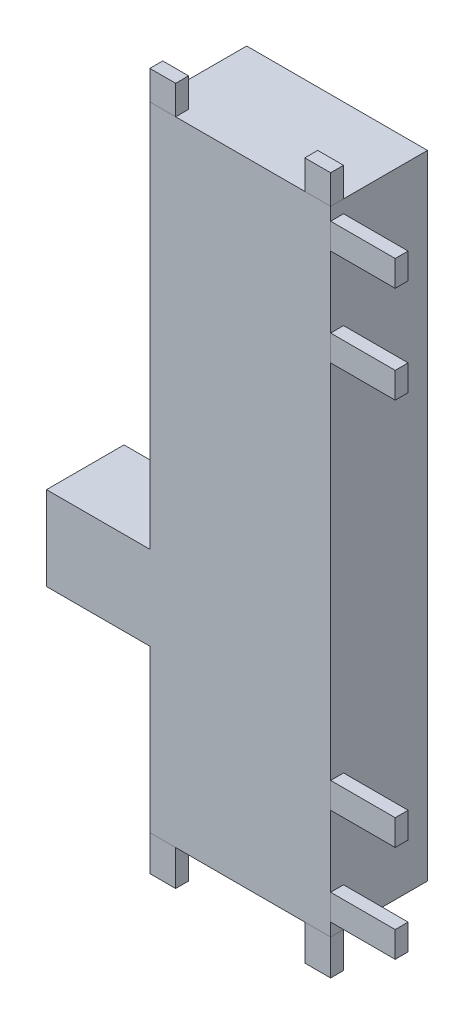
from build123d import *

# Parameters (mm, degrees)
SKETCH1_W             = 2.8
SKETCH1_H             = 9.8
BOSS_EXTRUDE1_DEPTH   = 1.5
SKETCH2_W             = 1
SKETCH2_H             = 0.4
BOSS_EXTRUDE2_DEPTH   = 0.2
BOSS_EXTRUDE2_2_DEPTH = 0.2
BOSS_EXTRUDE2_3_DEPTH = 0.2
BOSS_EXTRUDE2_4_DEPTH = 0.2
SKETCH2_W_2           = 1.6
SKETCH2_H_2           = 1.3
BOSS_EXTRUDE2_5_DEPTH = 0.2
SKETCH2_W_3           = 0.4
SKETCH2_H_3           = 0.55
BOSS_EXTRUDE2_6_DEPTH = 0.2
BOSS_EXTRUDE2_7_DEPTH = 0.2
SKETCH2_H_4           = 0.45
BOSS_EXTRUDE2_8_DEPTH = 0.2
BOSS_EXTRUDE2_9_DEPTH = 0.2
SKETCH3_R             = 0.4
BOSS_EXTRUDE3_DEPTH   = 0.5
CUT_EXTRUDE1_DEPTH    = 1
SKETCH5_W             = 1.6
SKETCH5_H             = 1.3
BOSS_EXTRUDE4_DEPTH   = 1
SKETCH6_W             = 2
SKETCH6_H             = 5.484754905
BOSS_EXTRUDE5_DEPTH   = 0.1


with BuildPart() as part:
    # Sketch1 → Boss-Extrude1 (new body)
    with BuildSketch(Plane.XY):
        Rectangle(SKETCH1_W, SKETCH1_H)
    extrude(amount=BOSS_EXTRUDE1_DEPTH)

    # Sketch3 → Boss-Extrude3 (add)
    with BuildSketch(Plane(origin=(0, 0, 0), x_dir=(-1, 0, 0), z_dir=(0, 0, -1))):
        with Locations(Location((0, -2.5, 0), (0, 0, 180))):
            Circle(SKETCH3_R)
        with Locations(Location((0, 2.5, 0), (0, 0, 180))):
            Circle(SKETCH3_R)
    extrude(amount=BOSS_EXTRUDE3_DEPTH)

    # Sketch4 → Cut-Extrude1 (cut, symmetric)
    with BuildSketch(Plane(origin=(0, 0, 0), x_dir=(0, 0, -1), z_dir=(1, 0, 0))):
        Polygon((-1.23487483, -2.869112244), (-0.744508889, -2.869112244), (-0.744508889, 1.309379028), (-0.190734918, 1.309379028), (-0.190734918, 2.615642661), (-1.23487483, 2.615642661), (-1.5, 2.615642661), (-1.5, -2.869112244), align=None)
    extrude(amount=CUT_EXTRUDE1_DEPTH, both=True, mode=Mode.SUBTRACT)



with BuildPart() as body_2:
    # Sketch2 → Boss-Extrude2 (new body)
    with BuildSketch(Plane.XY.offset(1.5)):
        with Locations((1.9, -4.5)):
            Rectangle(SKETCH2_W, SKETCH2_H)
    extrude(amount=-BOSS_EXTRUDE2_DEPTH)


with BuildPart() as body_3:
    # Sketch2 → Boss-Extrude2 2 (new body)
    with BuildSketch(Plane.XY.offset(1.5)):
        with Locations((1.9, -3)):
            Rectangle(SKETCH2_W, SKETCH2_H)
    extrude(amount=-BOSS_EXTRUDE2_2_DEPTH)


with BuildPart() as body_4:
    # Sketch2 → Boss-Extrude2 3 (new body)
    with BuildSketch(Plane.XY.offset(1.5)):
        with Locations((1.9, 3)):
            Rectangle(SKETCH2_W, SKETCH2_H)
    extrude(amount=-BOSS_EXTRUDE2_3_DEPTH)


with BuildPart() as body_5:
    # Sketch2 → Boss-Extrude2 4 (new body)
    with BuildSketch(Plane.XY.offset(1.5)):
        with Locations((1.9, 4.5)):
            Rectangle(SKETCH2_W, SKETCH2_H)
    extrude(amount=-BOSS_EXTRUDE2_4_DEPTH)


with BuildPart() as body_6:
    # Sketch2 → Boss-Extrude2 5 (new body)
    with BuildSketch(Plane.XY.offset(1.5)):
        with Locations((-2.2, -1.75)):
            Rectangle(SKETCH2_W_2, SKETCH2_H_2)
    extrude(amount=-BOSS_EXTRUDE2_5_DEPTH)


with BuildPart() as body_7:
    # Sketch2 → Boss-Extrude2 6 (new body)
    with BuildSketch(Plane.XY.offset(1.5)):
        with Locations((-1.2, -5.175)):
            Rectangle(SKETCH2_W_3, SKETCH2_H_3)
    extrude(amount=-BOSS_EXTRUDE2_6_DEPTH)


with BuildPart() as body_8:
    # Sketch2 → Boss-Extrude2 7 (new body)
    with BuildSketch(Plane.XY.offset(1.5)):
        with Locations((1.2, -5.175)):
            Rectangle(SKETCH2_W_3, SKETCH2_H_3)
    extrude(amount=-BOSS_EXTRUDE2_7_DEPTH)


with BuildPart() as body_9:
    # Sketch2 → Boss-Extrude2 8 (new body)
    with BuildSketch(Plane.XY.offset(1.5)):
        with Locations((-1.2, 5.125)):
            Rectangle(SKETCH2_W_3, SKETCH2_H_4)
    extrude(amount=-BOSS_EXTRUDE2_8_DEPTH)


with BuildPart() as body_10:
    # Sketch2 → Boss-Extrude2 9 (new body)
    with BuildSketch(Plane.XY.offset(1.5)):
        with Locations((1.2, 5.125)):
            Rectangle(SKETCH2_W_3, SKETCH2_H_4)
    extrude(amount=-BOSS_EXTRUDE2_9_DEPTH)


with BuildPart() as part_1:
    add(part.part)

    add(body_6.part)  # Boss-Extrude4 merges body 6
    # Sketch5 → Boss-Extrude4 (add)
    with BuildSketch(Plane(origin=(0, 0, 1.3), x_dir=(-1, 0, 0), z_dir=(0, 0, -1))):
        with Locations((2.2, -1.75)):
            Rectangle(SKETCH5_W, SKETCH5_H)
    extrude(amount=BOSS_EXTRUDE4_DEPTH)

    # Sketch6 → Boss-Extrude5 (add)
    with BuildSketch(Plane.XY.offset(1.5)):
        with Locations((0, -0.126734791)):
            Rectangle(SKETCH6_W, SKETCH6_H)
    extrude(amount=-BOSS_EXTRUDE5_DEPTH)


solid = Compound([body_2.part, body_3.part, body_4.part, body_5.part, body_7.part, body_8.part, body_9.part, body_10.part, part_1.part])
